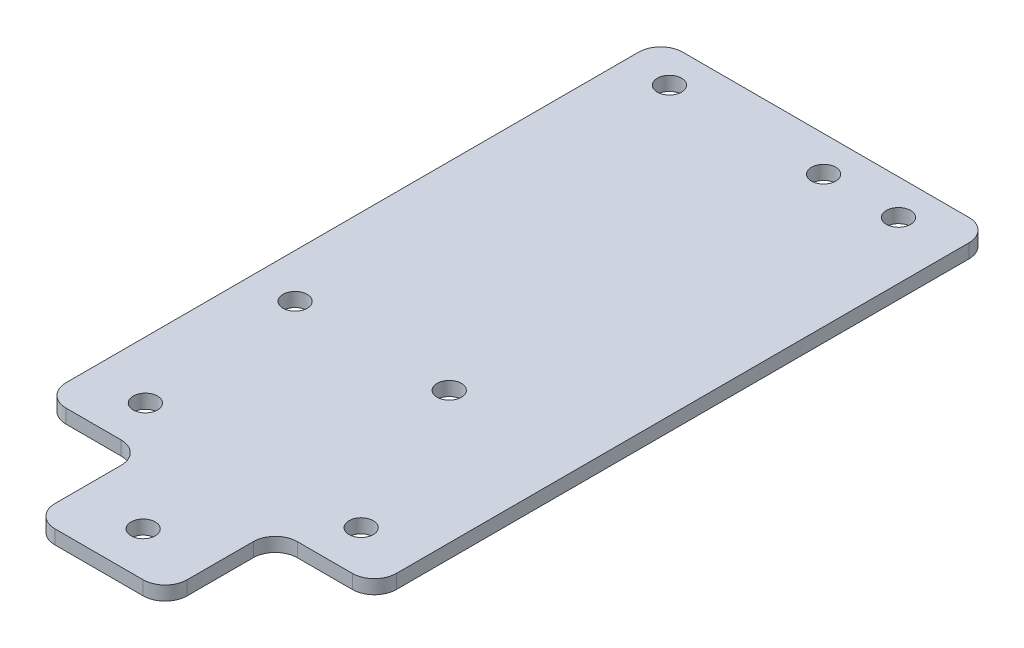
from build123d import *

# Parameters (mm, degrees)
SKETCH3_R           = 2.75
BOSS_EXTRUDE2_DEPTH = 3.175


with BuildPart() as part:
    # Sketch3 → Boss-Extrude2 (new body)
    with BuildSketch(Plane(origin=(0, 0, 0), x_dir=(1, 0, 0), z_dir=(0, 1, 0))):
        with BuildLine():
            Line((5, 0), (70, 0))
            ThreePointArc((70, 0), (73.535533906, -1.464466094), (75, -5))
            Line((75, -5), (75, -135))
            ThreePointArc((75, -135), (73.535533906, -138.535533906), (70, -140))
            Line((70, -140), (57.5, -140))
            ThreePointArc((57.5, -140), (53.964466094, -141.464466094), (52.5, -145))
            Line((52.5, -145), (52.5, -160))
            ThreePointArc((52.5, -160), (51.035533906, -163.535533906), (47.5, -165))
            Line((47.5, -165), (27.5, -165))
            ThreePointArc((27.5, -165), (23.964466094, -163.535533906), (22.5, -160))
            Line((22.5, -160), (22.5, -145))
            ThreePointArc((22.5, -145), (21.035533906, -141.464466094), (17.5, -140))
            Line((17.5, -140), (5, -140))
            ThreePointArc((5, -140), (1.464466094, -138.535533906), (0, -135))
            Line((0, -135), (0, -5))
            ThreePointArc((0, -5), (1.464466094, -1.464466094), (5, 0))
        make_face()
        with Locations(Location((10, -8, 0), (0, 0, 270))):
            Circle(SKETCH3_R, mode=Mode.SUBTRACT)
        with Locations(Location((45, -8, 0), (0, 0, 270))):
            Circle(SKETCH3_R, mode=Mode.SUBTRACT)
        with Locations(Location((62, -8, 0), (0, 0, 270))):
            Circle(SKETCH3_R, mode=Mode.SUBTRACT)
        with Locations(Location((45, -93, 0), (0, 0, 90))):
            Circle(SKETCH3_R, mode=Mode.SUBTRACT)
        with Locations(Location((10, -93, 0), (0, 0, 90))):
            Circle(SKETCH3_R, mode=Mode.SUBTRACT)
        with Locations(Location((37.5, -155, 0), (0, 0, 270))):
            Circle(SKETCH3_R, mode=Mode.SUBTRACT)
        with Locations(Location((62, -130, 0), (0, 0, 270))):
            Circle(SKETCH3_R, mode=Mode.SUBTRACT)
        with Locations(Location((13, -130, 0), (0, 0, 270))):
            Circle(SKETCH3_R, mode=Mode.SUBTRACT)
    extrude(amount=BOSS_EXTRUDE2_DEPTH)


solid = part.part
